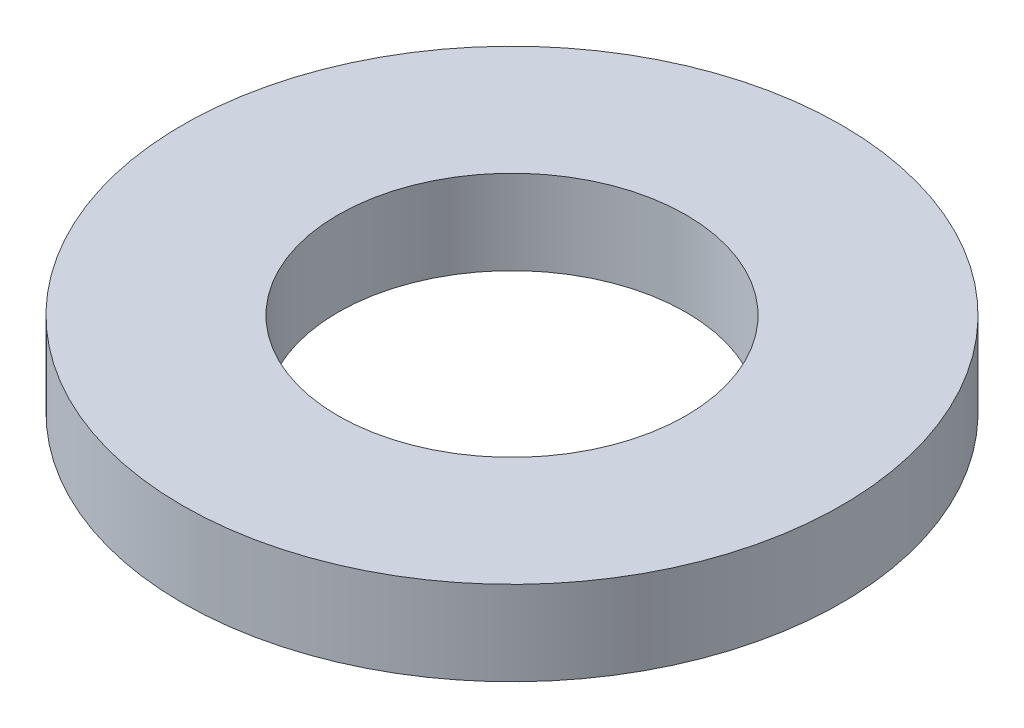
from build123d import *

# Parameters (mm, degrees)
BODYSKE_W = 2.95
BODYSKE_H = 1.6


with BuildPart() as part:
    # BodySke → BaseBody (revolve)
    with BuildSketch(Plane(origin=(0, 0, 0), x_dir=(1, 0, 0), z_dir=(0, 0, -1)), mode=Mode.PRIVATE) as basebody_sk:
        with Locations((4.775, 0.8)):
            Rectangle(BODYSKE_W, BODYSKE_H)
    revolve(basebody_sk.sketch.rotate(Axis((0, 0, 0), (0, -1, 0)), 90), axis=Axis((0, 0, 0), (0, -1, 0)))


solid = part.part
